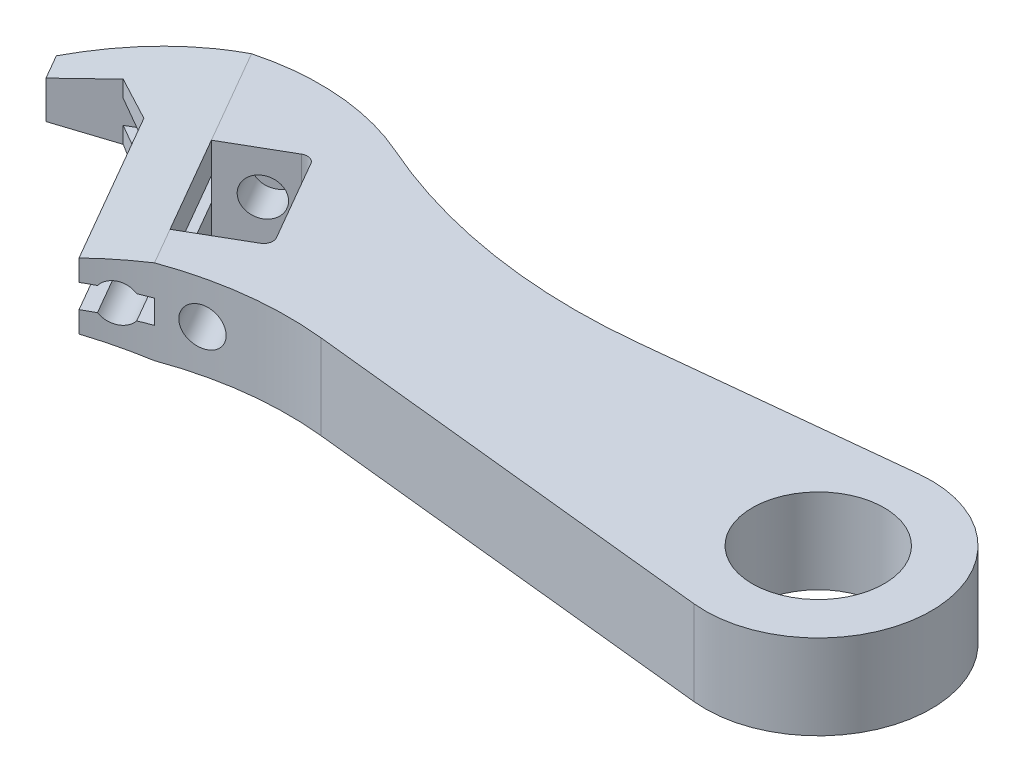
from build123d import *

# Parameters (mm, degrees)
SKETCH1_R                           = 7
BOSS_EXTRUDE1_DEPTH                 = 4.5
SKETCH2_R                           = 2
CUT_EXTRUDE1_DEPTH                  = 4
CUT_EXTRUDE1_DIRECTION_2_REACH      = 84.52
CUT_EXTRUDE1_DIRECTION_2_END_RADIUS = 35
CUT_EXTRUDE2_REACH                  = 85.44
CUT_EXTRUDE3_DEPTH                  = 84.439778024
CUT_EXTRUDE3_DEPTH_BACK             = 84.439778024
FILLET1_R                           = 1


with BuildPart() as part:
    # Sketch1 → Boss-Extrude1 (new, symmetric)
    # profile 1 of 2: a face of its own
    with BuildSketch(Plane(origin=(0, 0, 0), x_dir=(1, 0, 0), z_dir=(0, 1, 0))):
        with BuildLine():
            Line((-1.254341559, 11.934262744), (-28.287114055, 9.093003864))
            ThreePointArc((-28.287114055, 9.093003864), (-43.847711602, 9.487707298), (-58.78314626, 13.871858114))
            ThreePointArc((-58.78314626, 13.871858114), (-66.945926578, 15.925337372), (-75.327562788, 15.153369736))
            Line((-75.327562788, 15.153369736), (-69.509618943, 5.076395401))
            Line((-69.509618943, 5.076395401), (-62.581415713, 9.076395401))
            Line((-62.581415713, 9.076395401), (-56.581415713, -1.315909444))
            Line((-56.581415713, -1.315909444), (-63.509618943, -5.315909444))
            Line((-63.509618943, -5.315909444), (-61.251109949, -9.227761772))
            ThreePointArc((-61.251109949, -9.227761772), (-53.508040015, -7.353839298), (-45.541787079, -7.279464651))
            Line((-45.541787079, -7.279464651), (-1.254341559, -11.934262744))
            ThreePointArc((-1.254341559, -11.934262744), (12, 0), (-1.254341559, 11.934262744))
        make_face()
        with Locations(Location((0, 0, 0), (0, 0, 270))):
            Circle(SKETCH1_R, mode=Mode.SUBTRACT)
    # profile 2 of 2: a face of its own
    with BuildSketch(Plane(origin=(0, 0, 0), x_dir=(1, 0, 0), z_dir=(0, 1, 0))):
        with BuildLine():
            Line((-69.509618943, 5.076395401), (-75.327562788, 15.153369736))
            ThreePointArc((-75.327562788, 15.153369736), (-82.282399056, 12.101775932), (-88, 7.102674843))
            Line((-88, 7.102674843), (-86.5, 4.504598631))
            Line((-86.5, 4.504598631), (-81.303847577, 7.504598631))
            Line((-81.303847577, 7.504598631), (-76.107695155, 4.504598631))
            Line((-76.107695155, 4.504598631), (-66.705771366, -11.78001106))
            ThreePointArc((-66.705771366, -11.78001106), (-64.033436336, -10.386349776), (-61.251109949, -9.227761772))
            Line((-61.251109949, -9.227761772), (-63.509618943, -5.315909444))
            Line((-63.509618943, -5.315909444), (-69.509618943, 5.076395401))
        make_face()
    extrude(amount=BOSS_EXTRUDE1_DEPTH, both=True)

    # Sketch2 → Cut-Extrude1 (cut)
    with BuildSketch(Plane(origin=(-19.575548424, 0, -33.905844457), x_dir=(0.8660254037844372, 0, -0.5000000000000027), z_dir=(0.5000000000000027, 0, 0.8660254037844372))):
        with Locations(Location((-53.658898112, 0, 0), (0, 0, 180))):
            Circle(SKETCH2_R)
    extrude(amount=-CUT_EXTRUDE1_DEPTH, mode=Mode.SUBTRACT)

    # Cut-Extrude1 direction 2: up to this cylinder (the profile starts outside it)
    cut_extrude1_direction_2_end = Plane(origin=(-49.200283293, 0, 42.087730989), z_dir=(0, -1, 0)) * Cylinder(CUT_EXTRUDE1_DIRECTION_2_END_RADIUS, 240.04, mode=Mode.PRIVATE)
    # Sketch2 → Cut-Extrude1 direction 2 (cut, up to the surface)
    with BuildSketch(Plane(origin=(-19.575548424, 0, -33.905844457), x_dir=(0.8660254037844372, 0, -0.5000000000000027), z_dir=(0.5000000000000027, 0, 0.8660254037844372)), mode=Mode.PRIVATE) as cut_extrude1_direction_2_sk1:
        with Locations(Location((-53.658898112, 0, 0), (0, 0, 180))):
            Circle(SKETCH2_R)
    cut_extrude1_direction_2_tool1 = extrude(cut_extrude1_direction_2_sk1.sketch, amount=CUT_EXTRUDE1_DIRECTION_2_REACH, mode=Mode.PRIVATE) - cut_extrude1_direction_2_end
    add(cut_extrude1_direction_2_tool1.solids().sort_by_distance((-66.045517, 0, -7.076395))[0], mode=Mode.SUBTRACT)

    # Sketch3 → Cut-Extrude2 (cut, up to next)
    with BuildSketch(Plane(origin=(-23.575548424, 0, -40.834047687), x_dir=(0.8660254037844374, 0, -0.5000000000000023), z_dir=(0.5000000000000023, 0, 0.8660254037844374)), mode=Mode.PRIVATE) as cut_extrude2_sk1:
        with BuildLine():
            ThreePointArc((-62.220147611, 1.25), (-62.546025426, 0.662382443), (-62.658898112, 0))
            Line((-62.658898112, 0), (-58.658898112, 0))
            ThreePointArc((-58.658898112, 0), (-58.771770798, 0.662382443), (-59.097648612, 1.25))
            ThreePointArc((-59.097648612, 1.25), (-60.658898112, 2), (-62.220147611, 1.25))
        make_face()
    cut_extrude2_tool1 = extrude(cut_extrude2_sk1.sketch, amount=CUT_EXTRUDE2_REACH, mode=Mode.PRIVATE) & part.part
    # Sketch3 → Cut-Extrude2 (cut, up to next)
    with BuildSketch(Plane(origin=(-23.575548424, 0, -40.834047687), x_dir=(0.8660254037844374, 0, -0.5000000000000023), z_dir=(0.5000000000000023, 0, 0.8660254037844374)), mode=Mode.PRIVATE) as cut_extrude2_sk2:
        with BuildLine():
            Line((-58.658898112, 0), (-62.658898112, 0))
            ThreePointArc((-62.658898112, 0), (-62.546025426, -0.662382443), (-62.220147611, -1.25))
            ThreePointArc((-62.220147611, -1.25), (-60.658898112, -2), (-59.097648612, -1.25))
            ThreePointArc((-59.097648612, -1.25), (-58.771770798, -0.662382443), (-58.658898112, 0))
        make_face()
    cut_extrude2_tool2 = extrude(cut_extrude2_sk2.sketch, amount=CUT_EXTRUDE2_REACH, mode=Mode.PRIVATE) & part.part
    # Sketch3 → Cut-Extrude2 (cut, up to next)
    with BuildSketch(Plane(origin=(-23.575548424, 0, -40.834047687), x_dir=(0.8660254037844374, 0, -0.5000000000000023), z_dir=(0.5000000000000023, 0, 0.8660254037844374)), mode=Mode.PRIVATE) as cut_extrude2_sk3:
        with BuildLine():
            ThreePointArc((-62.220147611, 1.25), (-62.546025426, 0.662382443), (-62.658898112, 0))
            Line((-62.658898112, 0), (-58.658898112, 0))
            ThreePointArc((-58.658898112, 0), (-58.771770798, 0.662382443), (-59.097648612, 1.25))
            ThreePointArc((-59.097648612, 1.25), (-60.658898112, 2), (-62.220147611, 1.25))
        make_face()
    cut_extrude2_tool3 = extrude(cut_extrude2_sk3.sketch, amount=CUT_EXTRUDE2_REACH, mode=Mode.PRIVATE) & part.part
    # Sketch3 → Cut-Extrude2 (cut, up to next)
    with BuildSketch(Plane(origin=(-23.575548424, 0, -40.834047687), x_dir=(0.8660254037844374, 0, -0.5000000000000023), z_dir=(0.5000000000000023, 0, 0.8660254037844374)), mode=Mode.PRIVATE) as cut_extrude2_sk4:
        with BuildLine():
            Line((-58.658898112, 0), (-62.658898112, 0))
            ThreePointArc((-62.658898112, 0), (-62.546025426, -0.662382443), (-62.220147611, -1.25))
            ThreePointArc((-62.220147611, -1.25), (-60.658898112, -2), (-59.097648612, -1.25))
            ThreePointArc((-59.097648612, -1.25), (-58.771770798, -0.662382443), (-58.658898112, 0))
        make_face()
    cut_extrude2_tool4 = extrude(cut_extrude2_sk4.sketch, amount=CUT_EXTRUDE2_REACH, mode=Mode.PRIVATE) & part.part
    # Sketch3 → Cut-Extrude2 (cut, up to next)
    with BuildSketch(Plane(origin=(-23.575548424, 0, -40.834047687), x_dir=(0.8660254037844374, 0, -0.5000000000000023), z_dir=(0.5000000000000023, 0, 0.8660254037844374)), mode=Mode.PRIVATE) as cut_extrude2_sk5:
        with BuildLine():
            Line((-66.658898112, 1.25), (-66.658898112, 0))
            Line((-66.658898112, 0), (-62.658898112, 0))
            ThreePointArc((-62.658898112, 0), (-62.546025426, 0.662382443), (-62.220147611, 1.25))
            Line((-62.220147611, 1.25), (-66.658898112, 1.25))
        make_face()
    cut_extrude2_tool5 = extrude(cut_extrude2_sk5.sketch, amount=CUT_EXTRUDE2_REACH, mode=Mode.PRIVATE) & part.part
    # Sketch3 → Cut-Extrude2 (cut, up to next)
    with BuildSketch(Plane(origin=(-23.575548424, 0, -40.834047687), x_dir=(0.8660254037844374, 0, -0.5000000000000023), z_dir=(0.5000000000000023, 0, 0.8660254037844374)), mode=Mode.PRIVATE) as cut_extrude2_sk6:
        with BuildLine():
            Line((-62.658898112, 0), (-66.658898112, 0))
            Line((-66.658898112, 0), (-66.658898112, -1.25))
            Line((-66.658898112, -1.25), (-62.220147611, -1.25))
            ThreePointArc((-62.220147611, -1.25), (-62.546025426, -0.662382443), (-62.658898112, 0))
        make_face()
    cut_extrude2_tool6 = extrude(cut_extrude2_sk6.sketch, amount=CUT_EXTRUDE2_REACH, mode=Mode.PRIVATE) & part.part
    # Sketch3 → Cut-Extrude2 (cut, up to next)
    with BuildSketch(Plane(origin=(-23.575548424, 0, -40.834047687), x_dir=(0.8660254037844374, 0, -0.5000000000000023), z_dir=(0.5000000000000023, 0, 0.8660254037844374)), mode=Mode.PRIVATE) as cut_extrude2_sk7:
        with BuildLine():
            ThreePointArc((-59.097648612, 1.25), (-58.771770798, 0.662382443), (-58.658898112, 0))
            Line((-58.658898112, 0), (-57.658898112, 0))
            Line((-57.658898112, 0), (-57.658898112, 1.25))
            Line((-57.658898112, 1.25), (-59.097648612, 1.25))
        make_face()
    cut_extrude2_tool7 = extrude(cut_extrude2_sk7.sketch, amount=CUT_EXTRUDE2_REACH, mode=Mode.PRIVATE) & part.part
    # Sketch3 → Cut-Extrude2 (cut, up to next)
    with BuildSketch(Plane(origin=(-23.575548424, 0, -40.834047687), x_dir=(0.8660254037844374, 0, -0.5000000000000023), z_dir=(0.5000000000000023, 0, 0.8660254037844374)), mode=Mode.PRIVATE) as cut_extrude2_sk8:
        with BuildLine():
            Line((-57.658898112, 0), (-58.658898112, 0))
            ThreePointArc((-58.658898112, 0), (-58.771770798, -0.662382443), (-59.097648612, -1.25))
            Line((-59.097648612, -1.25), (-57.658898112, -1.25))
            Line((-57.658898112, -1.25), (-57.658898112, 0))
        make_face()
    cut_extrude2_tool8 = extrude(cut_extrude2_sk8.sketch, amount=CUT_EXTRUDE2_REACH, mode=Mode.PRIVATE) & part.part
    add(cut_extrude2_tool1.solids().sort_by_distance((-76.107695, 0.848826, -10.504599))[0], mode=Mode.SUBTRACT)
    add(cut_extrude2_tool2.solids().sort_by_distance((-76.107695, -0.848826, -10.504599))[0], mode=Mode.SUBTRACT)
    add(cut_extrude2_tool3.solids().sort_by_distance((-76.107695, 0.848826, -10.504599))[0], mode=Mode.SUBTRACT)
    add(cut_extrude2_tool4.solids().sort_by_distance((-76.107695, -0.848826, -10.504599))[0], mode=Mode.SUBTRACT)
    add(cut_extrude2_tool5.solids().sort_by_distance((-79.509815, 0.635751, -8.540384))[0], mode=Mode.SUBTRACT)
    add(cut_extrude2_tool6.solids().sort_by_distance((-79.509815, -0.635751, -8.540384))[0], mode=Mode.SUBTRACT)
    add(cut_extrude2_tool7.solids().sort_by_distance((-74.009148, 0.664064, -11.716195))[0], mode=Mode.SUBTRACT)
    add(cut_extrude2_tool8.solids().sort_by_distance((-74.009148, -0.664064, -11.716195))[0], mode=Mode.SUBTRACT)

    # Sketch4 → Cut-Extrude3 (cut, two sides: drawn at the far end of the back side and taken through both)
    with BuildSketch(Plane(origin=(-23.575548424, 0, -40.834047687), x_dir=(0.8660254037844374, 0, -0.5000000000000023), z_dir=(0.5000000000000023, 0, 0.8660254037844374)).offset(-CUT_EXTRUDE3_DEPTH_BACK)):
        Polygon((-57.658898112, 4.5), (-72.658898112, 4.5), (-72.658898112, 2), align=None)
        Polygon((-57.658898112, -4.5), (-72.658898112, -4.5), (-72.658898112, -2), align=None)
    extrude(amount=CUT_EXTRUDE3_DEPTH + CUT_EXTRUDE3_DEPTH_BACK, mode=Mode.SUBTRACT)

    # Fillet1
    fillet1_edges = [part.edges().sort_by_distance(p)[0] for p in [
        (-56.581415713, 0, 1.315909444),
        (-62.581415713, 0, -9.076395401),
    ]]
    fillet(fillet1_edges, radius=FILLET1_R)


solid = part.part
